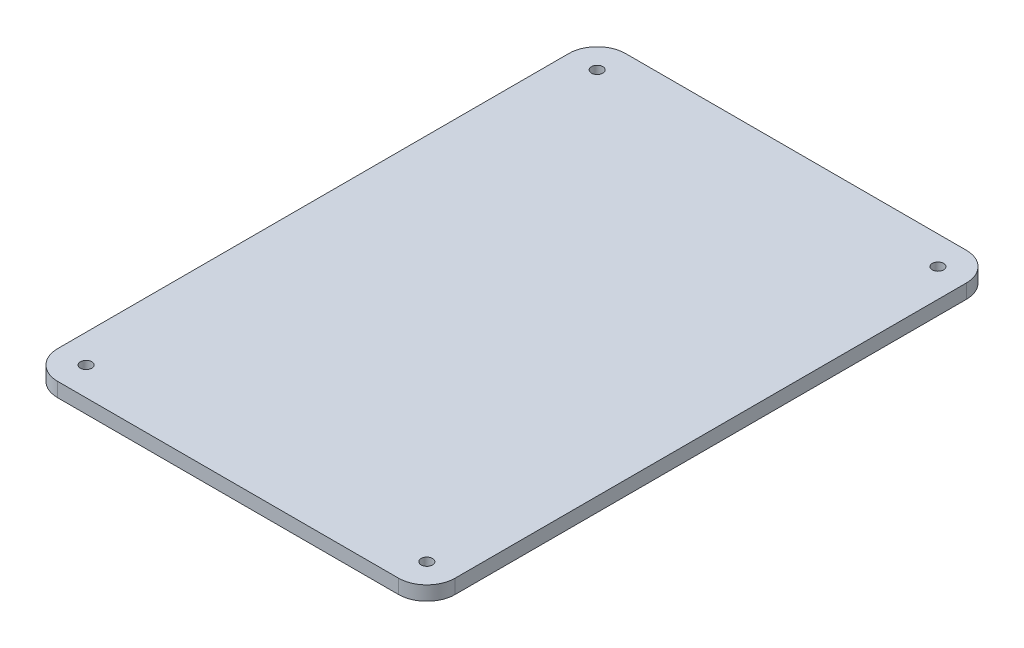
from build123d import *

# Parameters (mm, degrees)
SKETCH_1_W               = 180
SKETCH_1_H               = 180
EXTRUDE_1_DEPTH          = 5
SKETCH_2_W               = 180
SKETCH_2_H               = 2.5
EXTRUDE_2_DEPTH          = 5
CUT_EXTRUDE_1_DEPTH      = 130.155913531
CUT_EXTRUDE_1_DEPTH_BACK = 130.155913531
SKETCH_3_R               = 2.65
SKETCH_3_W               = 12.5
SKETCH_3_H               = 182.5
SKETCH_4_W               = 167.5
SKETCH_4_H               = 2.5
EXTRUDE_3_DEPTH          = 5
FILLET_1_R               = 10
SKETCH_5_R               = 5.825636989
EXTRUDE_4_DEPTH          = 5
CUT_EXTRUDE_2_DEPTH      = 130.155913531
CUT_EXTRUDE_2_DEPTH_BACK = 130.155913531
SKETCH_6_R               = 1.5
EXTRUDE_5_DEPTH          = 5
CUT_EXTRUDE_3_DEPTH      = 135.629120178
CUT_EXTRUDE_3_DEPTH_BACK = 135.629120178
FILLET_2_R               = 10
CUT_EXTRUDE_4_DEPTH      = 123.167917229
CUT_EXTRUDE_4_DEPTH_BACK = 123.167917229
SKETCH_9_R               = 2


with BuildPart() as part:
    # 草图1 → 凸台-拉伸1 (new body)
    with BuildSketch(Plane(origin=(0, 0, 0), x_dir=(1, 0, 0), z_dir=(0, 1, 0))):
        Rectangle(SKETCH_1_W, SKETCH_1_H)
    extrude(amount=EXTRUDE_1_DEPTH)

    # 草图2 → 凸台-拉伸2 (add)
    with BuildSketch(Plane(origin=(0, 5, 0), x_dir=(1, 0, 0), z_dir=(0, 1, 0))):
        with Locations((0, 91.25)):
            Rectangle(SKETCH_2_W, SKETCH_2_H)
    extrude(amount=-EXTRUDE_2_DEPTH)

    # 草图3 → 切除-拉伸1 (cut, two sides: drawn at the far end of the back side and taken through both)
    with BuildSketch(Plane(origin=(0, 5, 0), x_dir=(1, 0, 0), z_dir=(0, 1, 0)).offset(-CUT_EXTRUDE_1_DEPTH_BACK)):
        with Locations(Location((70, 80, 0), (0, 0, 270))):
            Circle(SKETCH_3_R)
        with Locations((83.75, 1.25)):
            Rectangle(SKETCH_3_W, SKETCH_3_H)
    extrude(amount=CUT_EXTRUDE_1_DEPTH + CUT_EXTRUDE_1_DEPTH_BACK, mode=Mode.SUBTRACT)

    # 草图4 → 凸台-拉伸3 (add)
    with BuildSketch(Plane(origin=(0, 5, 0), x_dir=(1, 0, 0), z_dir=(0, 1, 0))):
        with Locations((-6.25, -91.25)):
            Rectangle(SKETCH_4_W, SKETCH_4_H)
    extrude(amount=-EXTRUDE_3_DEPTH)

    # 圆角1
    fillet_1_edges = [part.edges().sort_by_distance(p)[0] for p in [
        (-90, 2.5, -92.5),
        (77.5, 2.5, -92.5),
        (77.5, 2.5, 92.5),
        (-90, 2.5, 92.5),
    ]]
    fillet(fillet_1_edges, radius=FILLET_1_R)

    # 草图5 → 凸台-拉伸4 (add)
    with BuildSketch(Plane(origin=(0, 5, 0), x_dir=(1, 0, 0), z_dir=(0, 1, 0))):
        with Locations((70, 80)):
            Circle(SKETCH_5_R)
    extrude(amount=-EXTRUDE_4_DEPTH)

    # 草图6 → 切除-拉伸2 (cut, two sides: drawn at the far end of the back side and taken through both)
    with BuildSketch(Plane(origin=(0, 5, 0), x_dir=(1, 0, 0), z_dir=(0, 1, 0)).offset(-CUT_EXTRUDE_2_DEPTH_BACK)):
        with Locations(Location((-82.5, 85, 0), (0, 0, 270))):
            Circle(SKETCH_6_R)
        with Locations(Location((70, 80, 0), (0, 0, 270))):
            Circle(SKETCH_6_R)
        with Locations(Location((-82.5, -85, 0), (0, 0, 270))):
            Circle(SKETCH_6_R)
        with Locations(Location((70, -80, 0), (0, 0, 270))):
            Circle(SKETCH_6_R)
    extrude(amount=CUT_EXTRUDE_2_DEPTH + CUT_EXTRUDE_2_DEPTH_BACK, mode=Mode.SUBTRACT)

    # 草图7 → 凸台-拉伸5 (add)
    with BuildSketch(Plane(origin=(0, 5, 0), x_dir=(1, 0, 0), z_dir=(0, 1, 0))):
        Polygon((-70, 100), (-70, 95.617586071), (-70, 92.5), (-70, -100), (70, -100), (70, 100), align=None)
    extrude(amount=-EXTRUDE_5_DEPTH)

    # 草图8 → 切除-拉伸3 (cut, two sides: drawn at the far end of the back side and taken through both)
    with BuildSketch(Plane(origin=(0, 5, 0), x_dir=(1, 0, 0), z_dir=(0, 1, 0)).offset(-CUT_EXTRUDE_3_DEPTH_BACK)):
        Polygon((-70, 100), (-70, -100), (-179.825652947, -100), (-179.825652947, 129.381792423), align=None)
        Polygon((70, 100), (70, -100), (197.420194338, -114.575162325), (173.755325689, 114.690896211), align=None)
    extrude(amount=CUT_EXTRUDE_3_DEPTH + CUT_EXTRUDE_3_DEPTH_BACK, mode=Mode.SUBTRACT)

    # 圆角2
    fillet_2_edges = [part.edges().sort_by_distance(p)[0] for p in [
        (70, 2.5, -100),
        (-70, 2.5, -100),
        (70, 2.5, 100),
        (-70, 2.5, 100),
    ]]
    fillet(fillet_2_edges, radius=FILLET_2_R)

    # 草图9 → 切除-拉伸4 (cut, two sides: drawn at the far end of the back side and taken through both)
    with BuildSketch(Plane(origin=(0, 5, 0), x_dir=(1, 0, 0), z_dir=(0, 1, 0)).offset(-CUT_EXTRUDE_4_DEPTH_BACK)):
        with Locations(Location((-60, 90, 0), (0, 0, 270))):
            Circle(SKETCH_9_R)
        with Locations(Location((60, 90, 0), (0, 0, 270))):
            Circle(SKETCH_9_R)
        with Locations(Location((-60, -90, 0), (0, 0, 270))):
            Circle(SKETCH_9_R)
        with Locations(Location((60, -90, 0), (0, 0, 270))):
            Circle(SKETCH_9_R)
    extrude(amount=CUT_EXTRUDE_4_DEPTH + CUT_EXTRUDE_4_DEPTH_BACK, mode=Mode.SUBTRACT)


solid = part.part
